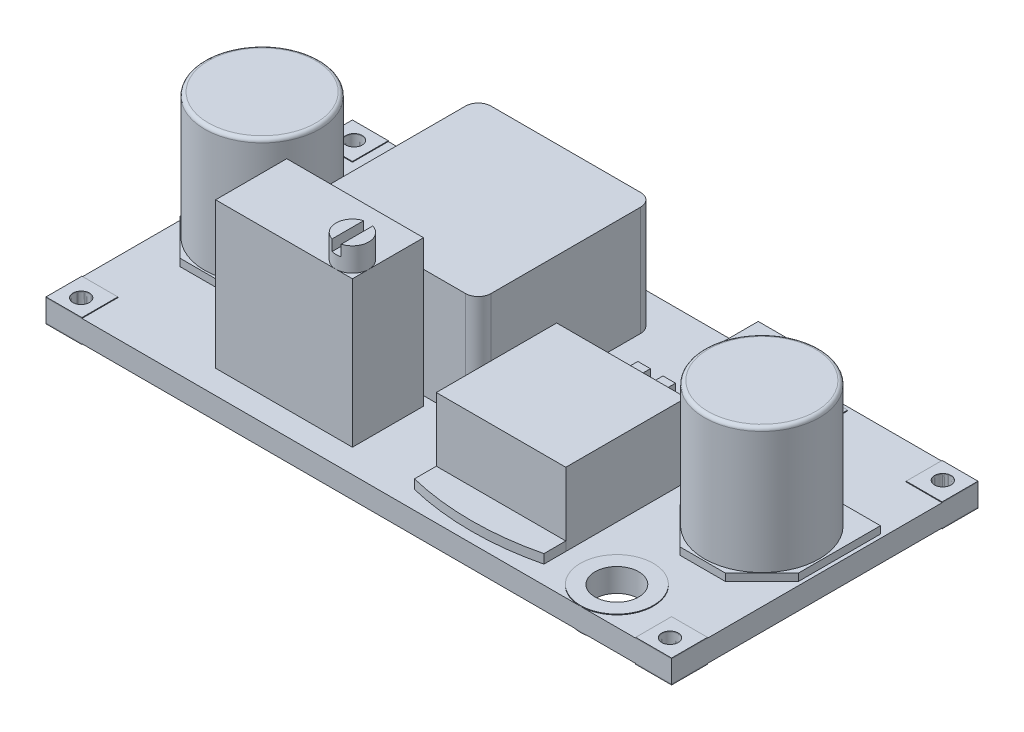
from build123d import *

# Parameters (mm, degrees)
SKETCH1_W                             = 43.561
SKETCH1_H                             = 21.336
SKETCH1_R                             = 1.651
BOSS_EXTRUDE1_DEPTH                   = 1.524
BOSS_EXTRUDE2_DEPTH                   = 0.0508
BOSS_EXTRUDE2_DEPTH_BACK              = 1.5748
SKETCH2_R                             = 2.54
SKETCH2_R_2                           = 1.524
BOSS_EXTRUDE2_2_DEPTH                 = 0.0508
BOSS_EXTRUDE2_2_DEPTH_BACK            = 1.5748
BOSS_EXTRUDE2_3_DEPTH                 = 0.0508
BOSS_EXTRUDE2_3_DEPTH_BACK            = 1.5748
SKETCH2_W                             = 2.5
SKETCH2_H                             = 2.5
BOSS_EXTRUDE2_4_DEPTH                 = 0.0508
BOSS_EXTRUDE2_4_DEPTH_BACK            = 1.5748
BOSS_EXTRUDE2_5_DEPTH                 = 0.0508
BOSS_EXTRUDE2_5_DEPTH_BACK            = 1.5748
BOSS_EXTRUDE2_6_DEPTH                 = 0.0508
BOSS_EXTRUDE2_6_DEPTH_BACK            = 1.5748
BOSS_EXTRUDE3_DEPTH                   = 0.508
BOSS_EXTRUDE3_2_DEPTH                 = 0.508
SKETCH4_R                             = 4.0005
BOSS_EXTRUDE4_DEPTH                   = 8.763
BOSS_EXTRUDE4_2_DEPTH                 = 8.763
FILLET1_R                             = 0.254
FILLET2_R                             = 0.254
BOSS_EXTRUDE5_DEPTH                   = 7.62
SKETCH6_W                             = 9.525
SKETCH6_H                             = 4.953
BOSS_EXTRUDE6_DEPTH                   = 10.16
SKETCH7_R                             = 1.143
BOSS_EXTRUDE7_DEPTH                   = 1.651
SKETCH8_W                             = 0.635
SKETCH8_H                             = 2.286
CUT_EXTRUDE1_DEPTH                    = 0.762
SKETCH9_W                             = 9.017
SKETCH9_H                             = 8.382
BOSS_EXTRUDE8_DEPTH                   = 5.08
BOSS_EXTRUDE9_DEPTH                   = 0.635
EXTRUDE_THIN1_DEPTH                   = 3.937
CUT_EXTRUDE2_START                    = -5.207
SKETCH12_W                            = 0.874888889
SKETCH12_H                            = 5.08
CUT_EXTRUDE2_DEPTH                    = 6.604
SKETCH13_W                            = 4.064
SKETCH13_H                            = 2.54
BOSS_EXTRUDE10_DEPTH                  = 2.54
SKETCH14_W                            = 2.54
SKETCH14_H                            = 3.048
BOSS_EXTRUDE11_DEPTH                  = 0.0508
BOSS_EXTRUDE11_2_DEPTH                = 0.0508
BOSS_EXTRUDE12_DEPTH                  = 0.01
SKETCH17_W                            = 0.575
SKETCH17_H                            = 1.6256
F_1_15_1_15_DIAMETER_HOLE1_AT_2_COUNT = 2
F_1_15_1_15_DIAMETER_HOLE1_AT_2_PITCH = 19
F_1_15_1_15_DIAMETER_HOLE1_AT_3_COUNT = 2
F_1_15_1_15_DIAMETER_HOLE1_AT_3_PITCH = 45.188494111
F_1_15_1_15_DIAMETER_HOLE1_AT_4_COUNT = 2
F_1_15_1_15_DIAMETER_HOLE1_AT_4_PITCH = 41


with BuildPart() as part:
    # Sketch1 → Boss-Extrude1 (new body)
    with BuildSketch(Plane(origin=(0, 0, 0), x_dir=(1, 0, 0), z_dir=(0, 1, 0))):
        Rectangle(SKETCH1_W, SKETCH1_H)
        with Locations(Location((-15.4305, 8.128, 0), (0, 0, 90))):
            Circle(SKETCH1_R, mode=Mode.SUBTRACT)
        with Locations(Location((15.4305, -8.128, 0), (0, 0, 90))):
            Circle(SKETCH1_R, mode=Mode.SUBTRACT)
    extrude(amount=BOSS_EXTRUDE1_DEPTH)

    # Sketch15 → Boss-Extrude12 (add)
    with BuildSketch(Plane.XZ):
        with BuildLine():
            ThreePointArc((7.5, 1), (8.5, 0), (7.5, -1))
            Line((7.5, -1), (-5.085786438, -1))
            Line((-5.085786438, -1), (-3.257359313, -2.828427125))
            ThreePointArc((-3.257359313, -2.828427125), (-3.257359313, -4.242640687), (-4.671572875, -4.242640687))
            Line((-4.671572875, -4.242640687), (-8.207106781, -0.707106781))
            ThreePointArc((-8.207106781, -0.707106781), (-8.5, 0), (-8.207106781, 0.707106781))
            Line((-8.207106781, 0.707106781), (-4.671572875, 4.242640687))
            ThreePointArc((-4.671572875, 4.242640687), (-3.257359313, 4.242640687), (-3.257359313, 2.828427125))
            Line((-3.257359313, 2.828427125), (-5.085786438, 1))
            Line((-5.085786438, 1), (7.5, 1))
        make_face()
    extrude(amount=BOSS_EXTRUDE12_DEPTH)


with BuildPart() as body_2:
    # Sketch2 → Boss-Extrude2 (new, two sides: drawn at the far end of the back side and taken through both)
    with BuildSketch(Plane(origin=(0, 1.524, 0), x_dir=(1, 0, 0), z_dir=(0, 1, 0)).offset(-BOSS_EXTRUDE2_DEPTH_BACK)):
        with Locations(Location((15.4305, -8.128, 0), (0, 0, 270))):
            Circle(SKETCH2_R)
        with Locations(Location((15.4305, -8.128, 0), (0, 0, 270))):
            Circle(SKETCH2_R_2, mode=Mode.SUBTRACT)
    extrude(amount=BOSS_EXTRUDE2_DEPTH + BOSS_EXTRUDE2_DEPTH_BACK)


with BuildPart() as body_3:
    # Sketch2 → Boss-Extrude2 2 (new, two sides: drawn at the far end of the back side and taken through both)
    with BuildSketch(Plane(origin=(0, 1.524, 0), x_dir=(1, 0, 0), z_dir=(0, 1, 0)).offset(-BOSS_EXTRUDE2_2_DEPTH_BACK)):
        with Locations(Location((-15.4305, 8.128, 0), (0, 0, 270))):
            Circle(SKETCH2_R)
        with Locations(Location((-15.4305, 8.128, 0), (0, 0, 270))):
            Circle(SKETCH2_R_2, mode=Mode.SUBTRACT)
    extrude(amount=BOSS_EXTRUDE2_2_DEPTH + BOSS_EXTRUDE2_2_DEPTH_BACK)


with BuildPart() as body_4:
    # Sketch2 → Boss-Extrude2 3 (new, two sides: drawn at the far end of the back side and taken through both)
    with BuildSketch(Plane(origin=(0, 1.524, 0), x_dir=(1, 0, 0), z_dir=(0, 1, 0)).offset(-BOSS_EXTRUDE2_3_DEPTH_BACK)):
        with Locations((-20.5305, 9.418)):
            Rectangle(SKETCH2_W, SKETCH2_H)
    extrude(amount=BOSS_EXTRUDE2_3_DEPTH + BOSS_EXTRUDE2_3_DEPTH_BACK)


with BuildPart() as body_5:
    # Sketch2 → Boss-Extrude2 4 (new, two sides: drawn at the far end of the back side and taken through both)
    with BuildSketch(Plane(origin=(0, 1.524, 0), x_dir=(1, 0, 0), z_dir=(0, 1, 0)).offset(-BOSS_EXTRUDE2_4_DEPTH_BACK)):
        with Locations((20.5305, 9.418)):
            Rectangle(SKETCH2_W, SKETCH2_H)
    extrude(amount=BOSS_EXTRUDE2_4_DEPTH + BOSS_EXTRUDE2_4_DEPTH_BACK)


with BuildPart() as body_6:
    # Sketch2 → Boss-Extrude2 5 (new, two sides: drawn at the far end of the back side and taken through both)
    with BuildSketch(Plane(origin=(0, 1.524, 0), x_dir=(1, 0, 0), z_dir=(0, 1, 0)).offset(-BOSS_EXTRUDE2_5_DEPTH_BACK)):
        with Locations((20.5305, -9.418)):
            Rectangle(SKETCH2_W, SKETCH2_H)
    extrude(amount=BOSS_EXTRUDE2_5_DEPTH + BOSS_EXTRUDE2_5_DEPTH_BACK)


with BuildPart() as body_7:
    # Sketch2 → Boss-Extrude2 6 (new, two sides: drawn at the far end of the back side and taken through both)
    with BuildSketch(Plane(origin=(0, 1.524, 0), x_dir=(1, 0, 0), z_dir=(0, 1, 0)).offset(-BOSS_EXTRUDE2_6_DEPTH_BACK)):
        with Locations((-20.5305, -9.418)):
            Rectangle(SKETCH2_W, SKETCH2_H)
    extrude(amount=BOSS_EXTRUDE2_6_DEPTH + BOSS_EXTRUDE2_6_DEPTH_BACK)


with BuildPart() as body_8:
    # Sketch3 → Boss-Extrude3 (new body)
    with BuildSketch(Plane(origin=(0, 1.524, 0), x_dir=(1, 0, 0), z_dir=(0, 1, 0))):
        Polygon((-21.5265, 4.1275), (-13.2715, 4.1275), (-13.2715, -1.5875), (-15.8115, -4.1275), (-18.9865, -4.1275), (-21.5265, -1.5875), align=None)
    extrude(amount=BOSS_EXTRUDE3_DEPTH)


with BuildPart() as body_9:
    # Sketch3 → Boss-Extrude3 2 (new body)
    with BuildSketch(Plane(origin=(0, 1.524, 0), x_dir=(1, 0, 0), z_dir=(0, 1, 0))):
        Polygon((13.2715, 4.1275), (21.5265, 4.1275), (21.5265, -1.5875), (18.9865, -4.1275), (15.8115, -4.1275), (13.2715, -1.5875), align=None)
    extrude(amount=BOSS_EXTRUDE3_2_DEPTH)


with BuildPart() as body_10:
    # Sketch4 → Boss-Extrude4 (new body)
    with BuildSketch(Plane(origin=(0, 2.032, 0), x_dir=(1, 0, 0), z_dir=(0, 1, 0))):
        with Locations(Location((-17.399, 0, 0), (0, 0, 270))):
            Circle(SKETCH4_R)
    extrude(amount=BOSS_EXTRUDE4_DEPTH)

    # Fillet1
    fillet1_edges = [body_10.edges().sort_by_distance(p)[0] for p in [
        (-17.399, 10.795, -4.0005),
    ]]
    fillet(fillet1_edges, radius=FILLET1_R)


with BuildPart() as body_11:
    # Sketch4 → Boss-Extrude4 2 (new body)
    with BuildSketch(Plane(origin=(0, 2.032, 0), x_dir=(1, 0, 0), z_dir=(0, 1, 0))):
        with Locations(Location((17.399, 0, 0), (0, 0, 270))):
            Circle(SKETCH4_R)
    extrude(amount=BOSS_EXTRUDE4_2_DEPTH)

    # Fillet2
    fillet2_edges = [body_11.edges().sort_by_distance(p)[0] for p in [
        (17.399, 10.795, -4.0005),
    ]]
    fillet(fillet2_edges, radius=FILLET2_R)


with BuildPart() as body_12:
    # Sketch5 → Boss-Extrude5 (new body)
    with BuildSketch(Plane(origin=(0, 1.524, 0), x_dir=(1, 0, 0), z_dir=(0, 1, 0))):
        with BuildLine():
            Line((-10.2235, 8.763), (0.1905, 8.763))
            ThreePointArc((0.1905, 8.763), (0.819117928, 8.502617928), (1.0795, 7.874))
            Line((1.0795, 7.874), (1.0795, -2.54))
            ThreePointArc((1.0795, -2.54), (0.819117928, -3.168617928), (0.1905, -3.429))
            Line((0.1905, -3.429), (-10.2235, -3.429))
            ThreePointArc((-10.2235, -3.429), (-10.852117928, -3.168617928), (-11.1125, -2.54))
            Line((-11.1125, -2.54), (-11.1125, 7.874))
            ThreePointArc((-11.1125, 7.874), (-10.852117928, 8.502617928), (-10.2235, 8.763))
        make_face()
    extrude(amount=BOSS_EXTRUDE5_DEPTH)


with BuildPart() as body_13:
    # Sketch6 → Boss-Extrude6 (new body)
    with BuildSketch(Plane(origin=(0, 1.524, 0), x_dir=(1, 0, 0), z_dir=(0, 1, 0))):
        with Locations((-6.858, -6.5405)):
            Rectangle(SKETCH6_W, SKETCH6_H)
    extrude(amount=BOSS_EXTRUDE6_DEPTH)

    # Sketch7 → Boss-Extrude7 (add)
    with BuildSketch(Plane(origin=(0, 11.684, 0), x_dir=(1, 0, 0), z_dir=(0, 1, 0))):
        with Locations(Location((-3.2385, -7.874, 0), (0, 0, 270))):
            Circle(SKETCH7_R)
    extrude(amount=BOSS_EXTRUDE7_DEPTH)

    # Sketch8 → Cut-Extrude1 (cut)
    with BuildSketch(Plane(origin=(0, 13.335, 0), x_dir=(1, 0, 0), z_dir=(0, 1, 0))):
        with Locations((-3.2385, -7.874)):
            Rectangle(SKETCH8_W, SKETCH8_H)
    extrude(amount=-CUT_EXTRUDE1_DEPTH, mode=Mode.SUBTRACT)


with BuildPart() as body_14:
    # Sketch9 → Boss-Extrude8 (new body)
    with BuildSketch(Plane(origin=(0, 1.524, 0), x_dir=(1, 0, 0), z_dir=(0, 1, 0))):
        with Locations((7.112, -3.683)):
            Rectangle(SKETCH9_W, SKETCH9_H)
    extrude(amount=BOSS_EXTRUDE8_DEPTH)


with BuildPart() as body_15:
    # Sketch10 → Boss-Extrude9 (new body)
    with BuildSketch(Plane(origin=(0, 1.524, 0), x_dir=(1, 0, 0), z_dir=(0, 1, 0))):
        with BuildLine():
            Line((2.6035, -7.874), (11.6205, -7.874))
            Line((11.6205, -7.874), (11.6205, -9.398))
            ThreePointArc((11.6205, -9.398), (7.112, -9.939193238), (2.6035, -9.398))
            Line((2.6035, -9.398), (2.6035, -7.874))
        make_face()
    extrude(amount=BOSS_EXTRUDE9_DEPTH)


with BuildPart() as body_16:
    # Sketch11 → Extrude-Thin1 (new, symmetric)
    with BuildSketch(Plane(origin=(7.112, 0, 0), x_dir=(0, 0, -1), z_dir=(1, 0, 0))):
        with BuildLine():
            Line((0.508, 4.699), (1.434067256, 4.699))
            ThreePointArc((1.434067256, 4.699), (1.718866691, 4.611658153), (1.905733415, 4.379666464))
            Line((1.905733415, 4.379666464), (2.920266585, 1.843333536))
            ThreePointArc((2.920266585, 1.843333536), (3.107133309, 1.611341847), (3.391932744, 1.524))
            Line((3.391932744, 1.524), (5.588, 1.524))
            Line((5.588, 1.524), (5.588, 2.032))
            Line((5.588, 2.032), (3.391932744, 2.032))
            Line((3.391932744, 2.032), (2.377399574, 4.568332927))
            ThreePointArc((2.377399574, 4.568332927), (2.003666126, 5.032316306), (1.434067256, 5.207))
            Line((1.434067256, 5.207), (0.508, 5.207))
            Line((0.508, 5.207), (0.508, 4.699))
        make_face()
    extrude(amount=EXTRUDE_THIN1_DEPTH, both=True)

    # Sketch12 → Cut-Extrude2 (cut)
    with BuildSketch(Plane(origin=(0, 5.207, 0), x_dir=(1, 0, 0), z_dir=(0, 1, 0)).offset(CUT_EXTRUDE2_START)):
        with Locations((4.487333334, 3.048)):
            Rectangle(SKETCH12_W, SKETCH12_H)
        with Locations((6.237111112, 3.048)):
            Rectangle(SKETCH12_W, SKETCH12_H)
        with Locations((7.986888889, 3.048)):
            Rectangle(SKETCH12_W, SKETCH12_H)
        with Locations((9.736666666, 3.048)):
            Rectangle(SKETCH12_W, SKETCH12_H)
    extrude(amount=CUT_EXTRUDE2_DEPTH, mode=Mode.SUBTRACT)


with BuildPart() as cut_extrude2_piece_1:
    # of the separate pieces the step leaves, piece 1, a body of its own (cut_extrude2_pieces)
    add(body_16.part.solids().sort_by_distance((9.299222222, 4.568332927, -2.377399574))[0])


with BuildPart() as cut_extrude2_piece_2:
    # of the separate pieces the step leaves, piece 2, a body of its own (cut_extrude2_pieces)
    add(body_16.part.solids().sort_by_distance((5.799666667, 4.568332927, -2.377399574))[0])


with BuildPart() as cut_extrude2_piece_3:
    # of the separate pieces the step leaves, piece 3, a body of its own (cut_extrude2_pieces)
    add(body_16.part.solids().sort_by_distance((11.049, 4.568332927, -2.377399574))[0])


with BuildPart() as cut_extrude2_piece_4:
    # of the separate pieces the step leaves, piece 4, a body of its own (cut_extrude2_pieces)
    add(body_16.part.solids().sort_by_distance((7.549444444, 4.568332927, -2.377399574))[0])


with BuildPart() as cut_extrude2_piece_5:
    # of the separate pieces the step leaves, piece 5, a body of its own (cut_extrude2_pieces)
    add(body_16.part.solids().sort_by_distance((4.049888889, 4.568332927, -2.377399574))[0])


with BuildPart() as body_21:
    # Sketch13 → Boss-Extrude10 (new body)
    with BuildSketch(Plane(origin=(0, 1.524, 0), x_dir=(1, 0, 0), z_dir=(0, 1, 0))):
        with Locations((9.017, 8.89)):
            Rectangle(SKETCH13_W, SKETCH13_H)
    extrude(amount=BOSS_EXTRUDE10_DEPTH)


with BuildPart() as body_22:
    # Sketch14 → Boss-Extrude11 (new body)
    with BuildSketch(Plane(origin=(0, 1.524, 0), x_dir=(1, 0, 0), z_dir=(0, 1, 0))):
        with Locations((6.35, 8.89)):
            Rectangle(SKETCH14_W, SKETCH14_H)
    extrude(amount=BOSS_EXTRUDE11_DEPTH)


with BuildPart() as body_23:
    # Sketch14 → Boss-Extrude11 2 (new body)
    with BuildSketch(Plane(origin=(0, 1.524, 0), x_dir=(1, 0, 0), z_dir=(0, 1, 0))):
        with Locations((11.684, 8.89)):
            Rectangle(SKETCH14_W, SKETCH14_H)
    extrude(amount=BOSS_EXTRUDE11_2_DEPTH)


with BuildPart() as f_1_15_1_15_diameter_hole1_tool:
    # Sketch17 → Ø1.15 (1.15) Diameter Hole1 (revolve)
    with BuildSketch(Plane(origin=(-20.5, 1.5748, 9.5), x_dir=(0, 0, 1), z_dir=(1, 0, 0))):
        with Locations((0.2875, 0.8128)):
            Rectangle(SKETCH17_W, SKETCH17_H)
    f_1_15_1_15_diameter_hole1 = revolve(axis=Axis((-20.5, 7.9248, 9.5), (0, -1, 0)))


with BuildPart() as part_1:
    add(part.part)

    # Ø1.15 (1.15) Diameter Hole1: cut by f_1_15_1_15_diameter_hole1_tool
    add(f_1_15_1_15_diameter_hole1_tool.part, mode=Mode.SUBTRACT)


with BuildPart() as body_7_1:
    add(body_7.part)

    # Ø1.15 (1.15) Diameter Hole1: cut by f_1_15_1_15_diameter_hole1_tool
    add(f_1_15_1_15_diameter_hole1_tool.part, mode=Mode.SUBTRACT)


with BuildPart() as f_1_15_1_15_diameter_hole1_at_2_tool:
    # Ø1.15 (1.15) Diameter Hole1 at 2: Ø1.15 (1.15) Diameter Hole1 ×2
    with Locations(*[(0, 0, -i * F_1_15_1_15_DIAMETER_HOLE1_AT_2_PITCH) for i in range(1, F_1_15_1_15_DIAMETER_HOLE1_AT_2_COUNT)]):
        add(f_1_15_1_15_diameter_hole1)


with BuildPart() as part_2:
    add(part_1.part)

    # Ø1.15 (1.15) Diameter Hole1 at 2: cut by f_1_15_1_15_diameter_hole1_at_2_tool
    add(f_1_15_1_15_diameter_hole1_at_2_tool.part, mode=Mode.SUBTRACT)


with BuildPart() as body_4_1:
    add(body_4.part)

    # Ø1.15 (1.15) Diameter Hole1 at 2: cut by f_1_15_1_15_diameter_hole1_at_2_tool
    add(f_1_15_1_15_diameter_hole1_at_2_tool.part, mode=Mode.SUBTRACT)


with BuildPart() as f_1_15_1_15_diameter_hole1_at_3_tool:
    # Ø1.15 (1.15) Diameter Hole1 at 3: Ø1.15 (1.15) Diameter Hole1 ×2
    with Locations(*[Vector(0.9073106065337809, 0, -0.4204610127839472) * (i * F_1_15_1_15_DIAMETER_HOLE1_AT_3_PITCH) for i in range(1, F_1_15_1_15_DIAMETER_HOLE1_AT_3_COUNT)]):
        add(f_1_15_1_15_diameter_hole1)


with BuildPart() as part_3:
    add(part_2.part)

    # Ø1.15 (1.15) Diameter Hole1 at 3: cut by f_1_15_1_15_diameter_hole1_at_3_tool
    add(f_1_15_1_15_diameter_hole1_at_3_tool.part, mode=Mode.SUBTRACT)


with BuildPart() as body_5_1:
    add(body_5.part)

    # Ø1.15 (1.15) Diameter Hole1 at 3: cut by f_1_15_1_15_diameter_hole1_at_3_tool
    add(f_1_15_1_15_diameter_hole1_at_3_tool.part, mode=Mode.SUBTRACT)


with BuildPart() as f_1_15_1_15_diameter_hole1_at_4_tool:
    # Ø1.15 (1.15) Diameter Hole1 at 4: Ø1.15 (1.15) Diameter Hole1 ×2
    with Locations(*[(i * F_1_15_1_15_DIAMETER_HOLE1_AT_4_PITCH, 0, 0) for i in range(1, F_1_15_1_15_DIAMETER_HOLE1_AT_4_COUNT)]):
        add(f_1_15_1_15_diameter_hole1)


with BuildPart() as part_4:
    add(part_3.part)

    # Ø1.15 (1.15) Diameter Hole1 at 4: cut by f_1_15_1_15_diameter_hole1_at_4_tool
    add(f_1_15_1_15_diameter_hole1_at_4_tool.part, mode=Mode.SUBTRACT)


with BuildPart() as body_6_1:
    add(body_6.part)

    # Ø1.15 (1.15) Diameter Hole1 at 4: cut by f_1_15_1_15_diameter_hole1_at_4_tool
    add(f_1_15_1_15_diameter_hole1_at_4_tool.part, mode=Mode.SUBTRACT)


solid = Compound([body_2.part, body_3.part, body_8.part, body_9.part, body_10.part, body_11.part, body_12.part, body_13.part, body_14.part, body_15.part, cut_extrude2_piece_1.part, cut_extrude2_piece_2.part, cut_extrude2_piece_3.part, cut_extrude2_piece_4.part, cut_extrude2_piece_5.part, body_21.part, body_22.part, body_23.part, body_7_1.part, body_4_1.part, body_5_1.part, part_4.part, body_6_1.part])
